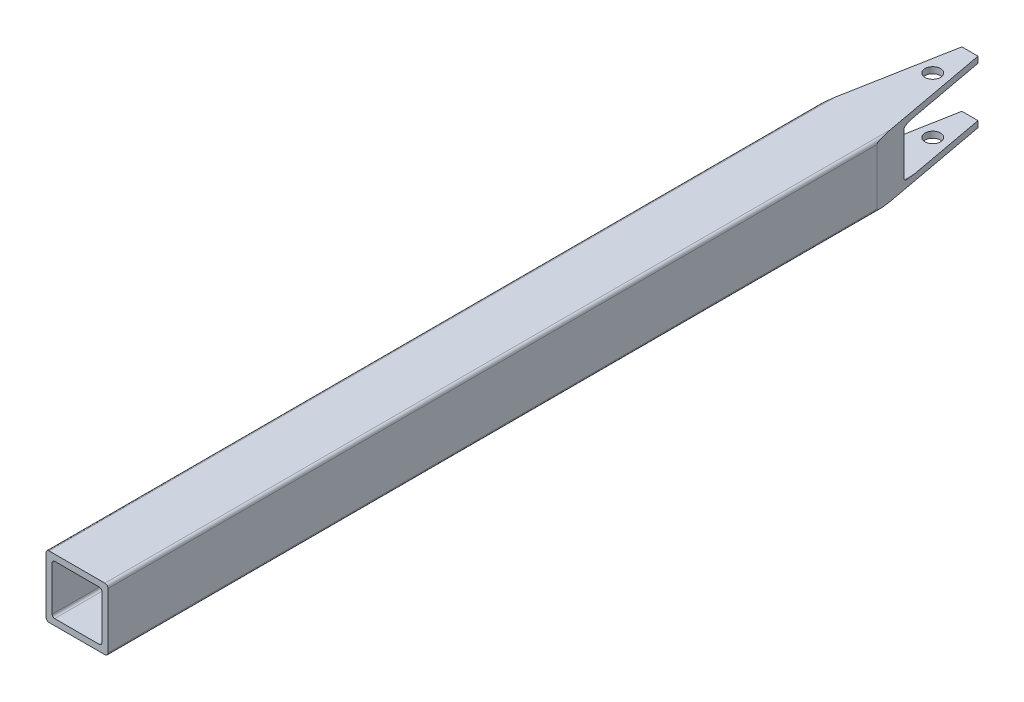
from build123d import *

# Parameters (mm, degrees)
BOSS_EXTRUDE1_DEPTH      = 457.2
BOSS_EXTRUDE1_DEPTH_BACK = 457.2
SKETCH6_R                = 7.9375
CUT_EXTRUDE1_DEPTH       = 463.679319291


with BuildPart() as part:
    # Sketch4 → Boss-Extrude1 (new, two sides: drawn at the far end of the back side and taken through both)
    with BuildSketch(Plane.XY.offset(-BOSS_EXTRUDE1_DEPTH_BACK)):
        with BuildLine():
            Line((31.75, -28.575), (31.75, 28.575))
            ThreePointArc((31.75, 28.575), (30.82006403, 30.82006403), (28.575, 31.75))
            Line((28.575, 31.75), (-28.575, 31.75))
            ThreePointArc((-28.575, 31.75), (-30.82006403, 30.82006403), (-31.75, 28.575))
            Line((-31.75, 28.575), (-31.75, -28.575))
            ThreePointArc((-31.75, -28.575), (-30.82006403, -30.82006403), (-28.575, -31.75))
            Line((-28.575, -31.75), (28.575, -31.75))
            ThreePointArc((28.575, -31.75), (30.82006403, -30.82006403), (31.75, -28.575))
        make_face()
        with BuildLine():
            Line((25.4, 22.86), (25.4, -22.86))
            ThreePointArc((25.4, -22.86), (24.656051224, -24.656051224), (22.86, -25.4))
            Line((22.86, -25.4), (-22.86, -25.4))
            ThreePointArc((-22.86, -25.4), (-24.656051224, -24.656051224), (-25.4, -22.86))
            Line((-25.4, -22.86), (-25.4, 22.86))
            ThreePointArc((-25.4, 22.86), (-24.656051224, 24.656051224), (-22.86, 25.4))
            Line((-22.86, 25.4), (22.86, 25.4))
            ThreePointArc((22.86, 25.4), (24.656051224, 24.656051224), (25.4, 22.86))
        make_face(mode=Mode.SUBTRACT)
    extrude(amount=BOSS_EXTRUDE1_DEPTH + BOSS_EXTRUDE1_DEPTH_BACK)

    # Sketch6 → Cut-Extrude1 (cut, through all)
    with BuildSketch(Plane(origin=(0, 31.75, 0), x_dir=(1, 0, 0), z_dir=(0, 1, 0))):
        with Locations(Location((0, 419.1, 0), (0, 0, 270))):
            Circle(SKETCH6_R)
        Polygon((8.255, 457.2), (31.75, 330.2), (31.75, 457.2), align=None)
        Polygon((-8.255, 457.2), (-31.75, 330.2), (-31.75, 457.2), align=None)
    extrude(amount=-CUT_EXTRUDE1_DEPTH, mode=Mode.SUBTRACT)


solid = part.part
